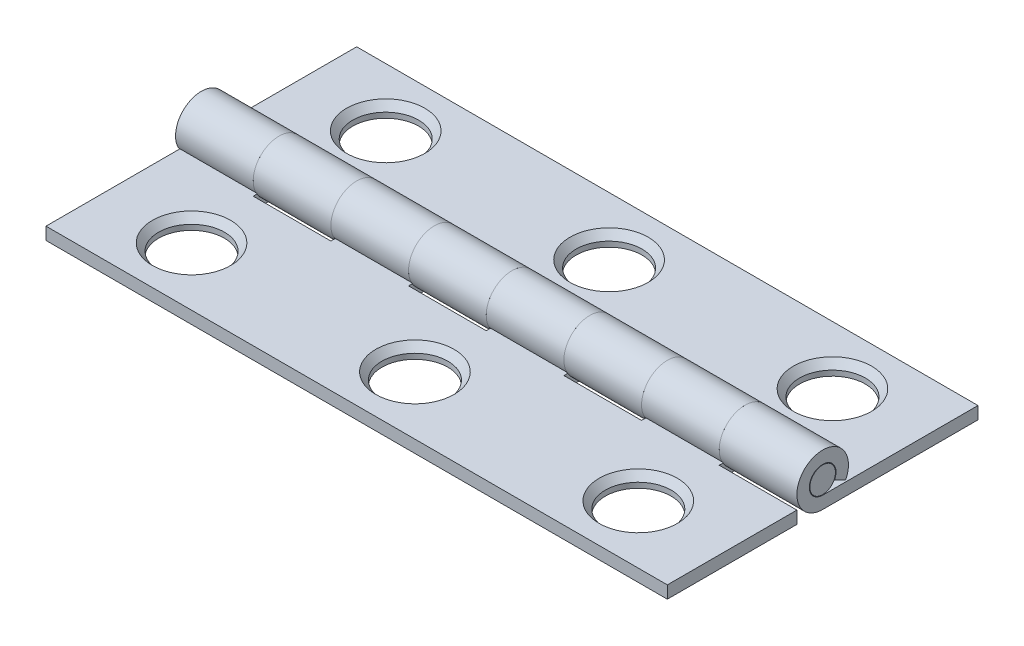
from build123d import *

# Parameters (mm, degrees)
BOSS_EXTRUDE1_DEPTH     = 25.4
SKETCH4_W               = 6.35
SKETCH4_H               = 4.2164
CUT_EXTRUDE1_DEPTH      = 29.476209496
LPATTERN1_COUNT         = 6
LPATTERN1_PITCH         = 12.7
CUT_EXTRUDE3_DEPTH      = 29.476209496
CUT_EXTRUDE3_DEPTH_BACK = 29.476209496
SKETCH9_R               = 2.6924
CIRPATTERN1_COUNT       = 2
SKETCH6_R               = 1.0922
BOSS_EXTRUDE2_DEPTH     = 25.4
CHAMFER1_SIZE           = 0.043688


with BuildPart() as part:
    # Sketch3 → Boss-Extrude1 (new, symmetric)
    with BuildSketch(Plane(origin=(0, 0, 0), x_dir=(0, 0, -1), z_dir=(1, 0, 0))):
        with BuildLine():
            Line((0, -2.1082), (-12.7, -2.1082))
            Line((-12.7, -2.1082), (-12.7, -1.0922))
            Line((-12.7, -1.0922), (0, -1.0922))
            ThreePointArc((0, -1.0922), (0.567521205, 0.933177647), (-0.96978228, -0.502417326))
            Line((-0.96978228, -0.502417326), (-1.871905331, -0.96978228))
            ThreePointArc((-1.871905331, -0.96978228), (1.095447908, 1.801249878), (0, -2.1082))
        make_face()
    extrude(amount=BOSS_EXTRUDE1_DEPTH, both=True)

    # Sketch4 → Cut-Extrude1 (cut, symmetric)
    with BuildSketch(Plane(origin=(0, 0, 0), x_dir=(1, 0, 0), z_dir=(0, 1, 0))):
        with Locations((-15.875, 0)):
            Rectangle(SKETCH4_W, SKETCH4_H)
    cut_extrude1 = extrude(amount=CUT_EXTRUDE1_DEPTH, both=True, mode=Mode.SUBTRACT)

    # LPattern1: Cut-Extrude1 ×6
    with Locations(*[(i * LPATTERN1_PITCH, 0, 0) for i in range(1, LPATTERN1_COUNT)]):
        add(cut_extrude1, mode=Mode.SUBTRACT)

    # Cut-Extrude2 cone 1 section (through the dimple's axis) → Cut-Extrude2 (revolve, cut)
    with BuildSketch(Plane(origin=(18.2626, -1.0922, 7.9375), x_dir=(0, 0, 1), z_dir=(1, 0, 0))):
        Polygon((0, 0), (3.2004, 0), (0, 3.68163905), align=None)
    revolve(axis=Axis((18.2626, -1.0922, 7.9375), (0, -1, 0)), mode=Mode.SUBTRACT)

    # Cut-Extrude2 cone 2 section (through the dimple's axis) → Cut-Extrude2 cone 2 (revolve, cut)
    with BuildSketch(Plane(origin=(0, -1.0922, 7.9375), x_dir=(0, 0, 1), z_dir=(1, 0, 0))):
        Polygon((0, 0), (3.2004, 0), (0, 3.68163905), align=None)
    revolve(axis=Axis((0, -1.0922, 7.9375), (0, -1, 0)), mode=Mode.SUBTRACT)

    # Cut-Extrude2 cone 3 section (through the dimple's axis) → Cut-Extrude2 cone 3 (revolve, cut)
    with BuildSketch(Plane(origin=(-18.2626, -1.0922, 7.9375), x_dir=(0, 0, 1), z_dir=(1, 0, 0))):
        Polygon((0, 0), (3.2004, 0), (0, 3.68163905), align=None)
    revolve(axis=Axis((-18.2626, -1.0922, 7.9375), (0, -1, 0)), mode=Mode.SUBTRACT)

    # Sketch9 → Cut-Extrude3 (cut, two sides: drawn at the far end of the back side and taken through both)
    with BuildSketch(Plane(origin=(0, 0, 0), x_dir=(1, 0, 0), z_dir=(0, 1, 0)).offset(-CUT_EXTRUDE3_DEPTH_BACK)):
        with Locations(Location((18.2626, -7.9375, 0), (0, 0, 270))):
            Circle(SKETCH9_R)
        with Locations(Location((0, -7.9375, 0), (0, 0, 270))):
            Circle(SKETCH9_R)
        with Locations(Location((-18.2626, -7.9375, 0), (0, 0, 270))):
            Circle(SKETCH9_R)
    extrude(amount=CUT_EXTRUDE3_DEPTH + CUT_EXTRUDE3_DEPTH_BACK, mode=Mode.SUBTRACT)


with BuildPart() as cirpattern1_1:
    # CirPattern1: pattern copy
    add(part.part.rotate(Axis((0, 0, 0), (0, 1, 0)), 1 * 360 / CIRPATTERN1_COUNT))


with BuildPart() as body_3:
    # Sketch6 → Boss-Extrude2 (new, symmetric)
    with BuildSketch(Plane(origin=(0, 0, 0), x_dir=(0, 0, -1), z_dir=(1, 0, 0))):
        Circle(SKETCH6_R)
    extrude(amount=BOSS_EXTRUDE2_DEPTH, both=True)

    # Chamfer1
    chamfer1_edges = [body_3.edges().sort_by_distance(p)[0] for p in [
        (-25.4, 0, 1.0922),
        (25.4, 0, 1.0922),
    ]]
    chamfer(chamfer1_edges, length=CHAMFER1_SIZE)


solid = Compound([part.part, cirpattern1_1.part, body_3.part])
